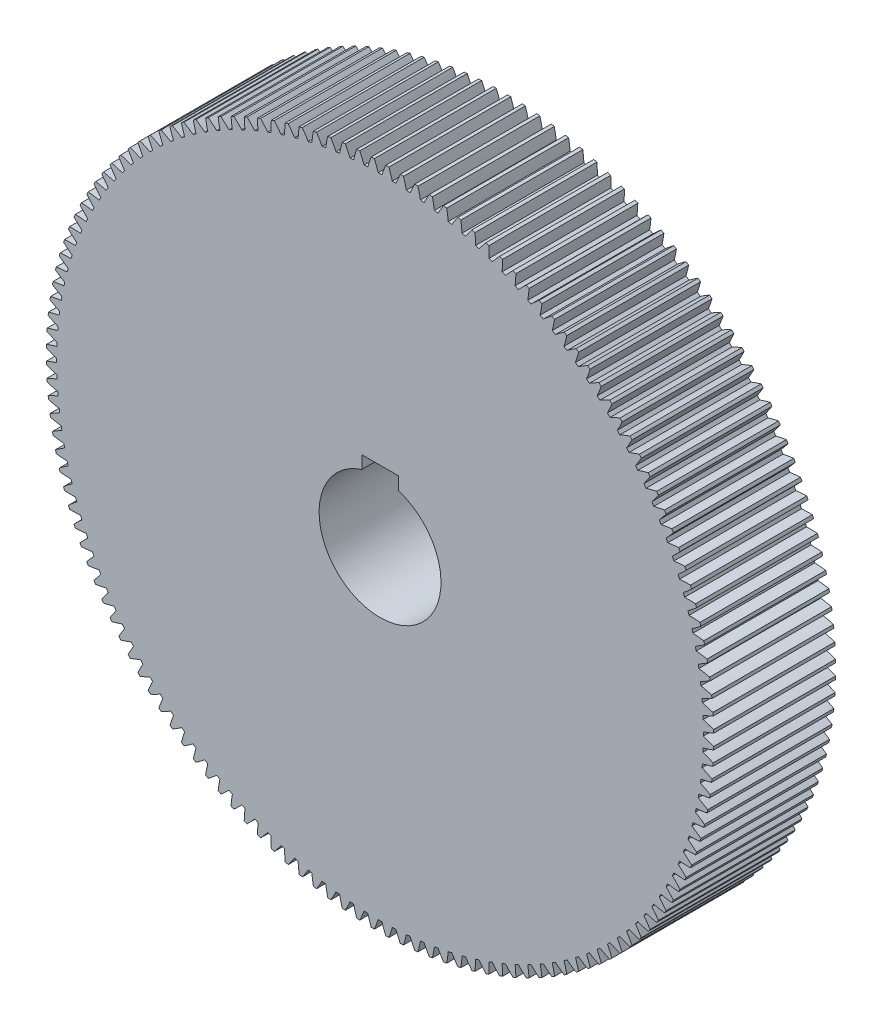
from build123d import *

# Parameters (mm, degrees)
EXTRUDE_1_DEPTH = 40


with BuildPart() as part:
    # Model → 凸台-拉伸1 (new body)
    with BuildSketch(Plane.XY):
        with BuildLine():
            ThreePointArc((-109.483974334, 1.873329678), (-107.816326162, 1.203872308), (-106.122279181, 0.604348814))
            ThreePointArc((-106.122279181, 0.604348814), (-106.124, 0), (-106.122279181, -0.604348814))
            ThreePointArc((-106.122279181, -0.604348814), (-107.816326162, -1.203872308), (-109.483974334, -1.873329678))
            ThreePointArc((-109.483974334, -1.873329678), (-109.473941965, -2.388729911), (-109.461483343, -2.904077204))
            ThreePointArc((-109.461483343, -2.904077204), (-107.766221082, -3.500155607), (-106.047635611, -4.025215196))
            ThreePointArc((-106.047635611, -4.025215196), (-106.022993467, -4.629063865), (-105.994912961, -5.232762411))
            ThreePointArc((-105.994912961, -5.232762411), (-107.661196737, -5.905608583), (-109.298056357, -6.64717057))
            ThreePointArc((-109.298056357, -6.64717057), (-109.265552095, -7.161642651), (-109.230626197, -7.67595601))
            ThreePointArc((-109.230626197, -7.67595601), (-107.510976876, -8.197520777), (-105.771124339, -8.64711698))
            ThreePointArc((-105.771124339, -8.64711698), (-105.72016614, -9.249316043), (-105.6657794, -9.851215148))
            ThreePointArc((-105.6657794, -9.851215148), (-107.301128105, -10.596103197), (-108.904083318, -11.408358195))
            ThreePointArc((-108.904083318, -11.408358195), (-108.849169035, -11.920922796), (-108.791842346, -12.433223197))
            ThreePointArc((-108.791842346, -12.433223197), (-107.051079414, -12.8792815), (-105.29327172, -13.252558486))
            ThreePointArc((-105.29327172, -13.252558486), (-105.216094468, -13.851961623), (-105.135505022, -14.450915537))
            ThreePointArc((-105.135505022, -14.450915537), (-106.736805677, -15.266427526), (-108.302805166, -16.147829361))
            ThreePointArc((-108.302805166, -16.147829361), (-108.225585396, -16.657510788), (-108.145967039, -17.166823036))
            ThreePointArc((-108.145967039, -17.166823036), (-106.387404138, -17.536525779), (-104.614987375, -17.832772993))
            ThreePointArc((-104.614987375, -17.832772993), (-104.511737981, -18.428239207), (-104.405099234, -19.023107787))
            ThreePointArc((-104.405099234, -19.023107787), (-105.969303673, -19.907691343), (-107.49536647, -20.856562217))
            ThreePointArc((-107.49536647, -20.856562217), (-107.395988204, -21.362390261), (-107.294229738, -21.867744853))
            ThreePointArc((-107.294229738, -21.867744853), (-105.521214392, -22.160388284), (-103.737562454, -22.379041803))
            ThreePointArc((-103.737562454, -22.379041803), (-103.60843746, -22.96943759), (-103.475952407, -23.55908847))
            ThreePointArc((-103.475952407, -23.55908847), (-105.000083077, -24.511059738), (-106.483304234, -25.525593421))
            ThreePointArc((-106.483304234, -25.525593421), (-106.361956645, -26.02660521), (-106.238251772, -26.527040174))
            ThreePointArc((-106.238251772, -26.527040174), (-104.454159017, -26.74206723), (-102.662667188, -26.882710835))
            ThreePointArc((-102.662667188, -26.882710835), (-102.507912389, -27.466912343), (-102.349833222, -28.050223089))
            ThreePointArc((-102.349833222, -28.050223089), (-103.830988854, -29.067769937), (-105.268544975, -30.146035208))
            ThreePointArc((-105.268544975, -30.146035208), (-105.125459055, -30.641277036), (-104.980043256, -31.135839767))
            ThreePointArc((-104.980043256, -31.135839767), (-103.188269213, -31.272841132), (-101.3923477, -31.335207099))
            ThreePointArc((-101.3923477, -31.335207099), (-101.212257681, -31.912102267), (-101.028885314, -32.487962514))
            ThreePointArc((-101.028885314, -32.487962514), (-102.464246443, -33.569147984), (-103.853401059, -34.709092303))
            ThreePointArc((-103.853401059, -34.709092303), (-103.68884918, -35.197621451), (-103.521999261, -35.685370519))
            ThreePointArc((-103.521999261, -35.685370519), (-101.725954674, -35.744085403), (-99.929022115, -35.728055015))
            ThreePointArc((-99.929022115, -35.728055015), (-99.723939688, -36.29654569), (-99.515623179, -36.863859256))
            ThreePointArc((-99.515623179, -36.863859256), (-100.902457516, -38.006625251), (-102.240566291, -39.206078668))
            ThreePointArc((-102.240566291, -39.206078668), (-102.054861686, -39.686965192), (-101.866895256, -40.16697214))
            ThreePointArc((-101.866895256, -40.16697214), (-100.069998998, -40.147288776), (-98.275475957, -40.052892548))
            ThreePointArc((-98.275475957, -40.052892548), (-98.045791508, -40.611896576), (-97.8129274, -41.169583547))
            ThreePointArc((-97.8129274, -41.169583547), (-99.148595025, -42.371754745), (-100.433110794, -43.628434034))
            ThreePointArc((-100.433110794, -43.628434034), (-100.226606964, -44.10076254), (-100.017881826, -44.572113647))
            ThreePointArc((-100.017881826, -44.572113647), (-98.223554392, -44.474069503), (-96.434856845, -44.301487124))
            ThreePointArc((-96.434856845, -44.301487124), (-96.181007591, -44.849940409), (-95.924039154, -45.396939195))
            ThreePointArc((-95.924039154, -45.396939195), (-97.205997548, -46.656227197), (-98.434475162, -47.967740196))
            ThreePointArc((-98.434475162, -47.967740196), (-98.207565198, -48.430611579), (-97.978478674, -48.892409602))
            ThreePointArc((-97.978478674, -48.892409602), (-96.190135668, -48.716191311), (-94.410668501, -48.4657513))
            ThreePointArc((-94.410668501, -48.4657513), (-94.13313766, -49.002609831), (-93.852554048, -49.53787919))
            ThreePointArc((-93.852554048, -49.53787919), (-95.078362931, -50.851886868), (-96.248463913, -52.215737038))
            ThreePointArc((-96.248463913, -52.215737038), (-96.00157975, -52.668270197), (-95.752567919, -53.119636077))
            ThreePointArc((-95.752567919, -53.119636077), (-93.973613553, -52.86557908), (-92.206764085, -52.537758165))
            ThreePointArc((-92.206764085, -52.537758165), (-91.906079951, -53.062), (-91.602415271, -53.584521016))
            ThreePointArc((-91.602415271, -53.584521016), (-92.769741245, -54.950747082), (-93.879238242, -56.364338257))
            ThreePointArc((-93.879238242, -56.364338257), (-93.612849839, -56.805671769), (-93.344386709, -57.245746305))
            ThreePointArc((-93.344386709, -57.245746305), (-91.578207323, -56.914334214), (-89.827338852, -56.509756421))
            ThreePointArc((-89.827338852, -56.509756421), (-89.504073795, -57.020383636), (-89.17790609, -57.52916166))
            ThreePointArc((-89.17790609, -57.52916166), (-90.284527085, -58.945005426), (-91.331308105, -60.405646755))
            ThreePointArc((-91.331308105, -60.405646755), (-91.045922547, -60.834940516), (-90.758519153, -61.262886001))
            ThreePointArc((-90.758519153, -61.262886001), (-89.008476771, -60.854749679), (-87.276922174, -60.374185144))
            ThreePointArc((-87.276922174, -60.374185144), (-86.931691548, -60.870225731), (-86.583641697, -61.364292276))
            ThreePointArc((-86.583641697, -61.364292276), (-87.627451195, -62.827058602), (-88.609523632, -64.331969671))
            ThreePointArc((-88.609523632, -64.331969671), (-88.305684167, -64.748406496), (-87.999887598, -65.163408312))
            ThreePointArc((-87.999887598, -65.163408312), (-86.269313525, -64.679324668), (-84.560368915, -64.123688174))
            ThreePointArc((-84.560368915, -64.123688174), (-84.193829885, -64.604197892), (-83.82456042, -65.082612474))
            ThreePointArc((-83.82456042, -65.082612474), (-84.803571472, -66.589516901), (-85.719065895, -68.135833026))
            ThreePointArc((-85.719065895, -68.135833026), (-85.397350899, -68.538620204), (-85.073743255, -68.939888371))
            ThreePointArc((-85.073743255, -68.939888371), (-83.365931737, -68.380778887), (-81.682850187, -67.751128119))
            ThreePointArc((-81.682850187, -67.751128119), (-81.295700482, -68.21519229), (-80.905914328, -68.677044219))
            ThreePointArc((-80.905914328, -68.677044219), (-81.818263331, -70.22521827), (-82.665437043, -71.809995951))
            ThreePointArc((-82.665437043, -71.809995951), (-82.326458919, -72.198366753), (-81.985656206, -72.585137435))
            ThreePointArc((-81.985656206, -72.585137435), (-80.30385816, -71.952066407), (-78.649843511, -71.249599941))
            ThreePointArc((-78.649843511, -71.249599941), (-78.242820092, -71.696335193), (-77.83325923, -72.140745308))
            ThreePointArc((-77.83325923, -72.140745308), (-78.677209475, -73.727241945), (-79.454449834, -75.347464466))
            ThreePointArc((-79.454449834, -75.347464466), (-79.098853846, -75.720679608), (-78.741504801, -76.092216564))
            ThreePointArc((-78.741504801, -76.092216564), (-77.088921624, -75.386389079), (-75.467122388, -74.612444099))
            ThreePointArc((-75.467122388, -74.612444099), (-75.041000047, -75.041000047), (-74.612444099, -75.467122388))
            ThreePointArc((-74.612444099, -75.467122388), (-75.386389079, -77.088921624), (-76.092216564, -78.741504801))
            ThreePointArc((-76.092216564, -78.741504801), (-75.720679608, -79.098853846), (-75.347464466, -79.454449834))
            ThreePointArc((-75.347464466, -79.454449834), (-73.727241945, -78.677209475), (-72.140745308, -77.83325923))
            ThreePointArc((-72.140745308, -77.83325923), (-71.696335193, -78.242820092), (-71.249599941, -78.649843511))
            ThreePointArc((-71.249599941, -78.649843511), (-71.952066407, -80.30385816), (-72.585137435, -81.985656206))
            ThreePointArc((-72.585137435, -81.985656206), (-72.198366753, -82.326458919), (-71.809995951, -82.665437043))
            ThreePointArc((-71.809995951, -82.665437043), (-70.22521827, -81.818263331), (-68.677044219, -80.905914328))
            ThreePointArc((-68.677044219, -80.905914328), (-68.21519229, -81.295700482), (-67.751128119, -81.682850187))
            ThreePointArc((-67.751128119, -81.682850187), (-68.380778887, -83.365931737), (-68.939888371, -85.073743255))
            ThreePointArc((-68.939888371, -85.073743255), (-68.538620204, -85.397350899), (-68.135833026, -85.719065895))
            ThreePointArc((-68.135833026, -85.719065895), (-66.589516901, -84.803571472), (-65.082612474, -83.82456042))
            ThreePointArc((-65.082612474, -83.82456042), (-64.604197892, -84.193829885), (-64.123688174, -84.560368915))
            ThreePointArc((-64.123688174, -84.560368915), (-64.679324668, -86.269313525), (-65.163408312, -87.999887598))
            ThreePointArc((-65.163408312, -87.999887598), (-64.748406496, -88.305684167), (-64.331969671, -88.609523632))
            ThreePointArc((-64.331969671, -88.609523632), (-62.827058602, -87.627451195), (-61.364292276, -86.583641697))
            ThreePointArc((-61.364292276, -86.583641697), (-60.870225731, -86.931691548), (-60.374185144, -87.276922174))
            ThreePointArc((-60.374185144, -87.276922174), (-60.854749679, -89.008476771), (-61.262886001, -90.758519153))
            ThreePointArc((-61.262886001, -90.758519153), (-60.834940516, -91.045922547), (-60.405646755, -91.331308105))
            ThreePointArc((-60.405646755, -91.331308105), (-58.945005426, -90.284527085), (-57.52916166, -89.17790609))
            ThreePointArc((-57.52916166, -89.17790609), (-57.020383636, -89.504073795), (-56.509756421, -89.827338852))
            ThreePointArc((-56.509756421, -89.827338852), (-56.914334214, -91.578207323), (-57.245746305, -93.344386709))
            ThreePointArc((-57.245746305, -93.344386709), (-56.805671769, -93.612849839), (-56.364338257, -93.879238242))
            ThreePointArc((-56.364338257, -93.879238242), (-54.950747082, -92.769741245), (-53.584521016, -91.602415271))
            ThreePointArc((-53.584521016, -91.602415271), (-53.062, -91.906079951), (-52.537758165, -92.206764085))
            ThreePointArc((-52.537758165, -92.206764085), (-52.86557908, -93.973613553), (-53.119636076, -95.752567919))
            ThreePointArc((-53.119636076, -95.752567919), (-52.668270197, -96.00157975), (-52.215737038, -96.248463913))
            ThreePointArc((-52.215737038, -96.248463913), (-50.851886868, -95.078362931), (-49.53787919, -93.852554048))
            ThreePointArc((-49.53787919, -93.852554048), (-49.002609831, -94.13313766), (-48.4657513, -94.410668501))
            ThreePointArc((-48.4657513, -94.410668501), (-48.716191311, -96.190135668), (-48.892409602, -97.978478674))
            ThreePointArc((-48.892409602, -97.978478674), (-48.430611579, -98.207565198), (-47.967740196, -98.434475162))
            ThreePointArc((-47.967740196, -98.434475162), (-46.656227197, -97.205997548), (-45.396939195, -95.924039155))
            ThreePointArc((-45.396939195, -95.924039155), (-44.849940409, -96.181007591), (-44.301487124, -96.434856845))
            ThreePointArc((-44.301487124, -96.434856845), (-44.474069503, -98.223554392), (-44.572113647, -100.017881826))
            ThreePointArc((-44.572113647, -100.017881826), (-44.10076254, -100.226606964), (-43.628434034, -100.433110794))
            ThreePointArc((-43.628434034, -100.433110794), (-42.371754745, -99.148595025), (-41.169583547, -97.8129274))
            ThreePointArc((-41.169583547, -97.8129274), (-40.611896576, -98.045791508), (-40.052892548, -98.275475957))
            ThreePointArc((-40.052892548, -98.275475957), (-40.147288776, -100.069998998), (-40.16697214, -101.866895256))
            ThreePointArc((-40.16697214, -101.866895256), (-39.686965192, -102.054861686), (-39.206078668, -102.240566291))
            ThreePointArc((-39.206078668, -102.240566291), (-38.006625251, -100.902457516), (-36.863859256, -99.515623179))
            ThreePointArc((-36.863859256, -99.515623179), (-36.29654569, -99.723939688), (-35.728055015, -99.929022115))
            ThreePointArc((-35.728055015, -99.929022115), (-35.744085403, -101.725954674), (-35.685370519, -103.521999261))
            ThreePointArc((-35.685370519, -103.521999261), (-35.197621451, -103.68884918), (-34.709092303, -103.853401059))
            ThreePointArc((-34.709092303, -103.853401059), (-33.569147984, -102.464246443), (-32.487962514, -101.028885314))
            ThreePointArc((-32.487962514, -101.028885314), (-31.912102267, -101.212257681), (-31.335207099, -101.3923477))
            ThreePointArc((-31.335207099, -101.3923477), (-31.272841132, -103.188269213), (-31.135839767, -104.980043256))
            ThreePointArc((-31.135839767, -104.980043256), (-30.641277036, -105.125459055), (-30.146035208, -105.268544975))
            ThreePointArc((-30.146035208, -105.268544975), (-29.067769937, -103.830988854), (-28.050223089, -102.349833223))
            ThreePointArc((-28.050223089, -102.349833223), (-27.466912342, -102.507912389), (-26.882710835, -102.662667188))
            ThreePointArc((-26.882710835, -102.662667188), (-26.74206723, -104.454159017), (-26.527040174, -106.238251772))
            ThreePointArc((-26.527040174, -106.238251772), (-26.02660521, -106.361956645), (-25.525593421, -106.483304234))
            ThreePointArc((-25.525593421, -106.483304234), (-24.511059738, -105.000083077), (-23.55908847, -103.475952407))
            ThreePointArc((-23.55908847, -103.475952407), (-22.96943759, -103.60843746), (-22.379041802, -103.737562455))
            ThreePointArc((-22.379041802, -103.737562455), (-22.160388284, -105.521214392), (-21.867744853, -107.294229738))
            ThreePointArc((-21.867744853, -107.294229738), (-21.362390261, -107.395988204), (-20.856562217, -107.49536647))
            ThreePointArc((-20.856562217, -107.49536647), (-19.907691343, -105.969303673), (-19.023107787, -104.405099234))
            ThreePointArc((-19.023107787, -104.405099234), (-18.428239207, -104.511737981), (-17.832772992, -104.614987375))
            ThreePointArc((-17.832772992, -104.614987375), (-17.536525779, -106.387404138), (-17.166823036, -108.145967039))
            ThreePointArc((-17.166823036, -108.145967039), (-16.657510788, -108.225585396), (-16.147829361, -108.302805166))
            ThreePointArc((-16.147829361, -108.302805166), (-15.266427526, -106.736805677), (-14.450915537, -105.135505022))
            ThreePointArc((-14.450915537, -105.135505022), (-13.851961623, -105.216094468), (-13.252558486, -105.29327172))
            ThreePointArc((-13.252558486, -105.29327172), (-12.8792815, -107.051079414), (-12.433223196, -108.791842346))
            ThreePointArc((-12.433223196, -108.791842346), (-11.920922796, -108.849169035), (-11.408358195, -108.904083318))
            ThreePointArc((-11.408358195, -108.904083318), (-10.596103197, -107.301128105), (-9.851215148, -105.6657794))
            ThreePointArc((-9.851215148, -105.6657794), (-9.249316043, -105.72016614), (-8.64711698, -105.771124339))
            ThreePointArc((-8.64711698, -105.771124339), (-8.197520777, -107.510976876), (-7.675956009, -109.230626197))
            ThreePointArc((-7.675956009, -109.230626197), (-7.161642651, -109.265552095), (-6.647170569, -109.298056357))
            ThreePointArc((-6.647170569, -109.298056357), (-5.905608583, -107.661196737), (-5.232762411, -105.994912961))
            ThreePointArc((-5.232762411, -105.994912961), (-4.629063865, -106.022993467), (-4.025215196, -106.047635611))
            ThreePointArc((-4.025215196, -106.047635611), (-3.500155607, -107.766221082), (-2.904077204, -109.461483343))
            ThreePointArc((-2.904077204, -109.461483343), (-2.388729911, -109.473941965), (-1.873329678, -109.483974334))
            ThreePointArc((-1.873329678, -109.483974334), (-1.203872308, -107.816326162), (-0.604348814, -106.122279181))
            ThreePointArc((-0.604348814, -106.122279181), (0, -106.124), (0.604348814, -106.122279181))
            ThreePointArc((0.604348814, -106.122279181), (1.203872308, -107.816326162), (1.873329678, -109.483974334))
            ThreePointArc((1.873329678, -109.483974334), (2.388729911, -109.473941965), (2.904077204, -109.461483343))
            ThreePointArc((2.904077204, -109.461483343), (3.500155607, -107.766221082), (4.025215196, -106.047635611))
            ThreePointArc((4.025215196, -106.047635611), (4.629063865, -106.022993467), (5.232762411, -105.994912961))
            ThreePointArc((5.232762411, -105.994912961), (5.905608583, -107.661196737), (6.64717057, -109.298056357))
            ThreePointArc((6.64717057, -109.298056357), (7.161642651, -109.265552095), (7.67595601, -109.230626197))
            ThreePointArc((7.67595601, -109.230626197), (8.197520777, -107.510976876), (8.64711698, -105.771124339))
            ThreePointArc((8.64711698, -105.771124339), (9.249316043, -105.72016614), (9.851215148, -105.6657794))
            ThreePointArc((9.851215148, -105.6657794), (10.596103197, -107.301128105), (11.408358195, -108.904083318))
            ThreePointArc((11.408358195, -108.904083318), (11.920922796, -108.849169035), (12.433223197, -108.791842346))
            ThreePointArc((12.433223197, -108.791842346), (12.8792815, -107.051079414), (13.252558486, -105.29327172))
            ThreePointArc((13.252558486, -105.29327172), (13.851961623, -105.216094468), (14.450915537, -105.135505022))
            ThreePointArc((14.450915537, -105.135505022), (15.266427526, -106.736805677), (16.147829361, -108.302805166))
            ThreePointArc((16.147829361, -108.302805166), (16.657510788, -108.225585396), (17.166823036, -108.145967039))
            ThreePointArc((17.166823036, -108.145967039), (17.536525779, -106.387404138), (17.832772993, -104.614987375))
            ThreePointArc((17.832772993, -104.614987375), (18.428239207, -104.511737981), (19.023107787, -104.405099234))
            ThreePointArc((19.023107787, -104.405099234), (19.907691343, -105.969303673), (20.856562217, -107.49536647))
            ThreePointArc((20.856562217, -107.49536647), (21.362390261, -107.395988204), (21.867744853, -107.294229738))
            ThreePointArc((21.867744853, -107.294229738), (22.160388284, -105.521214392), (22.379041803, -103.737562454))
            ThreePointArc((22.379041803, -103.737562454), (22.96943759, -103.60843746), (23.55908847, -103.475952407))
            ThreePointArc((23.55908847, -103.475952407), (24.511059738, -105.000083077), (25.525593421, -106.483304234))
            ThreePointArc((25.525593421, -106.483304234), (26.02660521, -106.361956645), (26.527040174, -106.238251772))
            ThreePointArc((26.527040174, -106.238251772), (26.74206723, -104.454159017), (26.882710835, -102.662667188))
            ThreePointArc((26.882710835, -102.662667188), (27.466912343, -102.507912389), (28.050223089, -102.349833222))
            ThreePointArc((28.050223089, -102.349833222), (29.067769937, -103.830988854), (30.146035208, -105.268544975))
            ThreePointArc((30.146035208, -105.268544975), (30.641277036, -105.125459055), (31.135839767, -104.980043256))
            ThreePointArc((31.135839767, -104.980043256), (31.272841132, -103.188269213), (31.335207099, -101.3923477))
            ThreePointArc((31.335207099, -101.3923477), (31.912102267, -101.212257681), (32.487962514, -101.028885314))
            ThreePointArc((32.487962514, -101.028885314), (33.569147984, -102.464246443), (34.709092303, -103.853401059))
            ThreePointArc((34.709092303, -103.853401059), (35.197621451, -103.68884918), (35.685370519, -103.521999261))
            ThreePointArc((35.685370519, -103.521999261), (35.744085403, -101.725954674), (35.728055015, -99.929022115))
            ThreePointArc((35.728055015, -99.929022115), (36.29654569, -99.723939688), (36.863859256, -99.515623179))
            ThreePointArc((36.863859256, -99.515623179), (38.006625251, -100.902457516), (39.206078668, -102.240566291))
            ThreePointArc((39.206078668, -102.240566291), (39.686965192, -102.054861686), (40.16697214, -101.866895256))
            ThreePointArc((40.16697214, -101.866895256), (40.147288776, -100.069998998), (40.052892548, -98.275475957))
            ThreePointArc((40.052892548, -98.275475957), (40.611896576, -98.045791508), (41.169583547, -97.8129274))
            ThreePointArc((41.169583547, -97.8129274), (42.371754745, -99.148595025), (43.628434034, -100.433110794))
            ThreePointArc((43.628434034, -100.433110794), (44.10076254, -100.226606964), (44.572113647, -100.017881826))
            ThreePointArc((44.572113647, -100.017881826), (44.474069503, -98.223554392), (44.301487124, -96.434856845))
            ThreePointArc((44.301487124, -96.434856845), (44.849940409, -96.181007591), (45.396939195, -95.924039154))
            ThreePointArc((45.396939195, -95.924039154), (46.656227197, -97.205997548), (47.967740196, -98.434475162))
            ThreePointArc((47.967740196, -98.434475162), (48.430611579, -98.207565198), (48.892409602, -97.978478674))
            ThreePointArc((48.892409602, -97.978478674), (48.716191311, -96.190135668), (48.4657513, -94.410668501))
            ThreePointArc((48.4657513, -94.410668501), (49.002609831, -94.13313766), (49.53787919, -93.852554048))
            ThreePointArc((49.53787919, -93.852554048), (50.851886868, -95.078362931), (52.215737038, -96.248463913))
            ThreePointArc((52.215737038, -96.248463913), (52.668270197, -96.00157975), (53.119636077, -95.752567919))
            ThreePointArc((53.119636077, -95.752567919), (52.86557908, -93.973613553), (52.537758165, -92.206764085))
            ThreePointArc((52.537758165, -92.206764085), (53.062, -91.906079951), (53.584521016, -91.602415271))
            ThreePointArc((53.584521016, -91.602415271), (54.950747082, -92.769741245), (56.364338257, -93.879238242))
            ThreePointArc((56.364338257, -93.879238242), (56.805671769, -93.612849839), (57.245746305, -93.344386709))
            ThreePointArc((57.245746305, -93.344386709), (56.914334214, -91.578207323), (56.509756421, -89.827338852))
            ThreePointArc((56.509756421, -89.827338852), (57.020383636, -89.504073795), (57.52916166, -89.17790609))
            ThreePointArc((57.52916166, -89.17790609), (58.945005426, -90.284527085), (60.405646755, -91.331308105))
            ThreePointArc((60.405646755, -91.331308105), (60.834940516, -91.045922547), (61.262886001, -90.758519153))
            ThreePointArc((61.262886001, -90.758519153), (60.854749679, -89.008476771), (60.374185144, -87.276922174))
            ThreePointArc((60.374185144, -87.276922174), (60.870225731, -86.931691548), (61.364292276, -86.583641697))
            ThreePointArc((61.364292276, -86.583641697), (62.827058602, -87.627451195), (64.331969671, -88.609523632))
            ThreePointArc((64.331969671, -88.609523632), (64.748406496, -88.305684167), (65.163408312, -87.999887598))
            ThreePointArc((65.163408312, -87.999887598), (64.679324668, -86.269313525), (64.123688174, -84.560368915))
            ThreePointArc((64.123688174, -84.560368915), (64.604197892, -84.193829885), (65.082612474, -83.82456042))
            ThreePointArc((65.082612474, -83.82456042), (66.589516901, -84.803571472), (68.135833026, -85.719065895))
            ThreePointArc((68.135833026, -85.719065895), (68.538620204, -85.397350899), (68.939888371, -85.073743255))
            ThreePointArc((68.939888371, -85.073743255), (68.380778887, -83.365931737), (67.751128119, -81.682850187))
            ThreePointArc((67.751128119, -81.682850187), (68.21519229, -81.295700482), (68.677044219, -80.905914328))
            ThreePointArc((68.677044219, -80.905914328), (70.22521827, -81.818263331), (71.809995951, -82.665437043))
            ThreePointArc((71.809995951, -82.665437043), (72.198366753, -82.326458919), (72.585137435, -81.985656206))
            ThreePointArc((72.585137435, -81.985656206), (71.952066407, -80.30385816), (71.249599941, -78.649843511))
            ThreePointArc((71.249599941, -78.649843511), (71.696335193, -78.242820092), (72.140745308, -77.83325923))
            ThreePointArc((72.140745308, -77.83325923), (73.727241945, -78.677209475), (75.347464466, -79.454449834))
            ThreePointArc((75.347464466, -79.454449834), (75.720679608, -79.098853846), (76.092216564, -78.741504801))
            ThreePointArc((76.092216564, -78.741504801), (75.386389079, -77.088921624), (74.612444099, -75.467122388))
            ThreePointArc((74.612444099, -75.467122388), (75.041000047, -75.041000047), (75.467122388, -74.612444099))
            ThreePointArc((75.467122388, -74.612444099), (77.088921624, -75.386389079), (78.741504801, -76.092216564))
            ThreePointArc((78.741504801, -76.092216564), (79.098853846, -75.720679608), (79.454449834, -75.347464466))
            ThreePointArc((79.454449834, -75.347464466), (78.677209475, -73.727241945), (77.83325923, -72.140745308))
            ThreePointArc((77.83325923, -72.140745308), (78.242820092, -71.696335193), (78.649843511, -71.249599941))
            ThreePointArc((78.649843511, -71.249599941), (80.30385816, -71.952066407), (81.985656206, -72.585137435))
            ThreePointArc((81.985656206, -72.585137435), (82.326458919, -72.198366753), (82.665437043, -71.809995951))
            ThreePointArc((82.665437043, -71.809995951), (81.818263331, -70.22521827), (80.905914328, -68.677044219))
            ThreePointArc((80.905914328, -68.677044219), (81.295700482, -68.21519229), (81.682850187, -67.751128119))
            ThreePointArc((81.682850187, -67.751128119), (83.365931737, -68.380778887), (85.073743255, -68.939888371))
            ThreePointArc((85.073743255, -68.939888371), (85.397350899, -68.538620204), (85.719065895, -68.135833026))
            ThreePointArc((85.719065895, -68.135833026), (84.803571472, -66.589516901), (83.82456042, -65.082612474))
            ThreePointArc((83.82456042, -65.082612474), (84.193829885, -64.604197892), (84.560368915, -64.123688174))
            ThreePointArc((84.560368915, -64.123688174), (86.269313525, -64.679324668), (87.999887598, -65.163408312))
            ThreePointArc((87.999887598, -65.163408312), (88.305684167, -64.748406496), (88.609523632, -64.331969671))
            ThreePointArc((88.609523632, -64.331969671), (87.627451195, -62.827058602), (86.583641697, -61.364292276))
            ThreePointArc((86.583641697, -61.364292276), (86.931691548, -60.870225731), (87.276922174, -60.374185144))
            ThreePointArc((87.276922174, -60.374185144), (89.008476771, -60.854749679), (90.758519153, -61.262886001))
            ThreePointArc((90.758519153, -61.262886001), (91.045922547, -60.834940516), (91.331308105, -60.405646755))
            ThreePointArc((91.331308105, -60.405646755), (90.284527085, -58.945005426), (89.17790609, -57.52916166))
            ThreePointArc((89.17790609, -57.52916166), (89.504073795, -57.020383636), (89.827338852, -56.509756421))
            ThreePointArc((89.827338852, -56.509756421), (91.578207323, -56.914334214), (93.344386709, -57.245746305))
            ThreePointArc((93.344386709, -57.245746305), (93.612849839, -56.805671769), (93.879238242, -56.364338257))
            ThreePointArc((93.879238242, -56.364338257), (92.769741245, -54.950747082), (91.602415271, -53.584521016))
            ThreePointArc((91.602415271, -53.584521016), (91.906079951, -53.062), (92.206764085, -52.537758165))
            ThreePointArc((92.206764085, -52.537758165), (93.973613553, -52.86557908), (95.752567919, -53.119636076))
            ThreePointArc((95.752567919, -53.119636076), (96.00157975, -52.668270197), (96.248463913, -52.215737038))
            ThreePointArc((96.248463913, -52.215737038), (95.078362931, -50.851886868), (93.852554048, -49.53787919))
            ThreePointArc((93.852554048, -49.53787919), (94.13313766, -49.002609831), (94.410668501, -48.4657513))
            ThreePointArc((94.410668501, -48.4657513), (96.190135668, -48.716191311), (97.978478674, -48.892409602))
            ThreePointArc((97.978478674, -48.892409602), (98.207565198, -48.430611579), (98.434475162, -47.967740196))
            ThreePointArc((98.434475162, -47.967740196), (97.205997548, -46.656227197), (95.924039155, -45.396939195))
            ThreePointArc((95.924039155, -45.396939195), (96.181007591, -44.849940409), (96.434856845, -44.301487124))
            ThreePointArc((96.434856845, -44.301487124), (98.223554392, -44.474069503), (100.017881826, -44.572113647))
            ThreePointArc((100.017881826, -44.572113647), (100.226606964, -44.10076254), (100.433110794, -43.628434034))
            ThreePointArc((100.433110794, -43.628434034), (99.148595025, -42.371754745), (97.8129274, -41.169583547))
            ThreePointArc((97.8129274, -41.169583547), (98.045791508, -40.611896576), (98.275475957, -40.052892548))
            ThreePointArc((98.275475957, -40.052892548), (100.069998998, -40.147288776), (101.866895256, -40.16697214))
            ThreePointArc((101.866895256, -40.16697214), (102.054861686, -39.686965192), (102.240566291, -39.206078668))
            ThreePointArc((102.240566291, -39.206078668), (100.902457516, -38.006625251), (99.515623179, -36.863859256))
            ThreePointArc((99.515623179, -36.863859256), (99.723939688, -36.29654569), (99.929022115, -35.728055015))
            ThreePointArc((99.929022115, -35.728055015), (101.725954674, -35.744085403), (103.521999261, -35.685370519))
            ThreePointArc((103.521999261, -35.685370519), (103.68884918, -35.197621451), (103.853401059, -34.709092303))
            ThreePointArc((103.853401059, -34.709092303), (102.464246443, -33.569147984), (101.028885314, -32.487962514))
            ThreePointArc((101.028885314, -32.487962514), (101.212257681, -31.912102267), (101.3923477, -31.335207099))
            ThreePointArc((101.3923477, -31.335207099), (103.188269213, -31.272841132), (104.980043256, -31.135839767))
            ThreePointArc((104.980043256, -31.135839767), (105.125459055, -30.641277036), (105.268544975, -30.146035208))
            ThreePointArc((105.268544975, -30.146035208), (103.830988854, -29.067769937), (102.349833223, -28.050223089))
            ThreePointArc((102.349833223, -28.050223089), (102.507912389, -27.466912342), (102.662667188, -26.882710835))
            ThreePointArc((102.662667188, -26.882710835), (104.454159017, -26.74206723), (106.238251772, -26.527040174))
            ThreePointArc((106.238251772, -26.527040174), (106.361956645, -26.02660521), (106.483304234, -25.525593421))
            ThreePointArc((106.483304234, -25.525593421), (105.000083077, -24.511059738), (103.475952407, -23.55908847))
            ThreePointArc((103.475952407, -23.55908847), (103.60843746, -22.96943759), (103.737562455, -22.379041802))
            ThreePointArc((103.737562455, -22.379041802), (105.521214392, -22.160388284), (107.294229738, -21.867744853))
            ThreePointArc((107.294229738, -21.867744853), (107.395988204, -21.362390261), (107.49536647, -20.856562217))
            ThreePointArc((107.49536647, -20.856562217), (105.969303673, -19.907691343), (104.405099234, -19.023107787))
            ThreePointArc((104.405099234, -19.023107787), (104.511737981, -18.428239207), (104.614987375, -17.832772992))
            ThreePointArc((104.614987375, -17.832772992), (106.387404138, -17.536525779), (108.145967039, -17.166823036))
            ThreePointArc((108.145967039, -17.166823036), (108.225585396, -16.657510788), (108.302805166, -16.147829361))
            ThreePointArc((108.302805166, -16.147829361), (106.736805677, -15.266427526), (105.135505022, -14.450915537))
            ThreePointArc((105.135505022, -14.450915537), (105.216094468, -13.851961623), (105.29327172, -13.252558486))
            ThreePointArc((105.29327172, -13.252558486), (107.051079414, -12.8792815), (108.791842346, -12.433223196))
            ThreePointArc((108.791842346, -12.433223196), (108.849169035, -11.920922796), (108.904083318, -11.408358195))
            ThreePointArc((108.904083318, -11.408358195), (107.301128105, -10.596103197), (105.6657794, -9.851215148))
            ThreePointArc((105.6657794, -9.851215148), (105.72016614, -9.249316043), (105.771124339, -8.64711698))
            ThreePointArc((105.771124339, -8.64711698), (107.510976876, -8.197520777), (109.230626197, -7.675956009))
            ThreePointArc((109.230626197, -7.675956009), (109.265552095, -7.161642651), (109.298056357, -6.647170569))
            ThreePointArc((109.298056357, -6.647170569), (107.661196737, -5.905608583), (105.994912961, -5.232762411))
            ThreePointArc((105.994912961, -5.232762411), (106.022993467, -4.629063865), (106.047635611, -4.025215196))
            ThreePointArc((106.047635611, -4.025215196), (107.766221082, -3.500155607), (109.461483343, -2.904077204))
            ThreePointArc((109.461483343, -2.904077204), (109.473941965, -2.388729911), (109.483974334, -1.873329678))
            ThreePointArc((109.483974334, -1.873329678), (107.816326162, -1.203872308), (106.122279181, -0.604348814))
            ThreePointArc((106.122279181, -0.604348814), (106.124, 0), (106.122279181, 0.604348814))
            ThreePointArc((106.122279181, 0.604348814), (107.816326162, 1.203872308), (109.483974334, 1.873329678))
            ThreePointArc((109.483974334, 1.873329678), (109.473941965, 2.388729911), (109.461483343, 2.904077204))
            ThreePointArc((109.461483343, 2.904077204), (107.766221082, 3.500155607), (106.047635611, 4.025215196))
            ThreePointArc((106.047635611, 4.025215196), (106.022993467, 4.629063865), (105.994912961, 5.232762411))
            ThreePointArc((105.994912961, 5.232762411), (107.661196737, 5.905608583), (109.298056357, 6.64717057))
            ThreePointArc((109.298056357, 6.64717057), (109.265552095, 7.161642651), (109.230626197, 7.67595601))
            ThreePointArc((109.230626197, 7.67595601), (107.510976876, 8.197520777), (105.771124339, 8.64711698))
            ThreePointArc((105.771124339, 8.64711698), (105.72016614, 9.249316043), (105.6657794, 9.851215148))
            ThreePointArc((105.6657794, 9.851215148), (107.301128105, 10.596103197), (108.904083318, 11.408358195))
            ThreePointArc((108.904083318, 11.408358195), (108.849169035, 11.920922796), (108.791842346, 12.433223197))
            ThreePointArc((108.791842346, 12.433223197), (107.051079414, 12.8792815), (105.29327172, 13.252558486))
            ThreePointArc((105.29327172, 13.252558486), (105.216094468, 13.851961623), (105.135505022, 14.450915537))
            ThreePointArc((105.135505022, 14.450915537), (106.736805677, 15.266427526), (108.302805166, 16.147829361))
            ThreePointArc((108.302805166, 16.147829361), (108.225585396, 16.657510788), (108.145967039, 17.166823036))
            ThreePointArc((108.145967039, 17.166823036), (106.387404138, 17.536525779), (104.614987375, 17.832772993))
            ThreePointArc((104.614987375, 17.832772993), (104.511737981, 18.428239207), (104.405099234, 19.023107787))
            ThreePointArc((104.405099234, 19.023107787), (105.969303673, 19.907691343), (107.49536647, 20.856562217))
            ThreePointArc((107.49536647, 20.856562217), (107.395988204, 21.362390261), (107.294229738, 21.867744853))
            ThreePointArc((107.294229738, 21.867744853), (105.521214392, 22.160388284), (103.737562454, 22.379041803))
            ThreePointArc((103.737562454, 22.379041803), (103.60843746, 22.96943759), (103.475952407, 23.55908847))
            ThreePointArc((103.475952407, 23.55908847), (105.000083077, 24.511059738), (106.483304234, 25.525593421))
            ThreePointArc((106.483304234, 25.525593421), (106.361956645, 26.02660521), (106.238251772, 26.527040174))
            ThreePointArc((106.238251772, 26.527040174), (104.454159017, 26.74206723), (102.662667188, 26.882710835))
            ThreePointArc((102.662667188, 26.882710835), (102.507912389, 27.466912343), (102.349833222, 28.050223089))
            ThreePointArc((102.349833222, 28.050223089), (103.830988854, 29.067769937), (105.268544975, 30.146035208))
            ThreePointArc((105.268544975, 30.146035208), (105.125459055, 30.641277036), (104.980043256, 31.135839767))
            ThreePointArc((104.980043256, 31.135839767), (103.188269213, 31.272841132), (101.3923477, 31.335207099))
            ThreePointArc((101.3923477, 31.335207099), (101.212257681, 31.912102267), (101.028885314, 32.487962514))
            ThreePointArc((101.028885314, 32.487962514), (102.464246443, 33.569147984), (103.853401059, 34.709092303))
            ThreePointArc((103.853401059, 34.709092303), (103.68884918, 35.197621451), (103.521999261, 35.685370519))
            ThreePointArc((103.521999261, 35.685370519), (101.725954674, 35.744085403), (99.929022115, 35.728055015))
            ThreePointArc((99.929022115, 35.728055015), (99.723939688, 36.29654569), (99.515623179, 36.863859256))
            ThreePointArc((99.515623179, 36.863859256), (100.902457516, 38.006625251), (102.240566291, 39.206078668))
            ThreePointArc((102.240566291, 39.206078668), (102.054861686, 39.686965192), (101.866895256, 40.16697214))
            ThreePointArc((101.866895256, 40.16697214), (100.069998998, 40.147288776), (98.275475957, 40.052892548))
            ThreePointArc((98.275475957, 40.052892548), (98.045791508, 40.611896576), (97.8129274, 41.169583547))
            ThreePointArc((97.8129274, 41.169583547), (99.148595025, 42.371754745), (100.433110794, 43.628434034))
            ThreePointArc((100.433110794, 43.628434034), (100.226606964, 44.10076254), (100.017881826, 44.572113647))
            ThreePointArc((100.017881826, 44.572113647), (98.223554392, 44.474069503), (96.434856845, 44.301487124))
            ThreePointArc((96.434856845, 44.301487124), (96.181007591, 44.849940409), (95.924039154, 45.396939195))
            ThreePointArc((95.924039154, 45.396939195), (97.205997548, 46.656227197), (98.434475162, 47.967740196))
            ThreePointArc((98.434475162, 47.967740196), (98.207565198, 48.430611579), (97.978478674, 48.892409602))
            ThreePointArc((97.978478674, 48.892409602), (96.190135668, 48.716191311), (94.410668501, 48.4657513))
            ThreePointArc((94.410668501, 48.4657513), (94.13313766, 49.002609831), (93.852554048, 49.53787919))
            ThreePointArc((93.852554048, 49.53787919), (95.078362931, 50.851886868), (96.248463913, 52.215737038))
            ThreePointArc((96.248463913, 52.215737038), (96.00157975, 52.668270197), (95.752567919, 53.119636077))
            ThreePointArc((95.752567919, 53.119636077), (93.973613553, 52.86557908), (92.206764085, 52.537758165))
            ThreePointArc((92.206764085, 52.537758165), (91.906079951, 53.062), (91.602415271, 53.584521016))
            ThreePointArc((91.602415271, 53.584521016), (92.769741245, 54.950747082), (93.879238242, 56.364338257))
            ThreePointArc((93.879238242, 56.364338257), (93.612849839, 56.805671769), (93.344386709, 57.245746305))
            ThreePointArc((93.344386709, 57.245746305), (91.578207323, 56.914334214), (89.827338852, 56.509756421))
            ThreePointArc((89.827338852, 56.509756421), (89.504073795, 57.020383636), (89.17790609, 57.52916166))
            ThreePointArc((89.17790609, 57.52916166), (90.284527085, 58.945005426), (91.331308105, 60.405646755))
            ThreePointArc((91.331308105, 60.405646755), (91.045922547, 60.834940516), (90.758519153, 61.262886001))
            ThreePointArc((90.758519153, 61.262886001), (89.008476771, 60.854749679), (87.276922174, 60.374185144))
            ThreePointArc((87.276922174, 60.374185144), (86.931691548, 60.870225731), (86.583641697, 61.364292276))
            ThreePointArc((86.583641697, 61.364292276), (87.627451195, 62.827058602), (88.609523632, 64.331969671))
            ThreePointArc((88.609523632, 64.331969671), (88.305684167, 64.748406496), (87.999887598, 65.163408312))
            ThreePointArc((87.999887598, 65.163408312), (86.269313525, 64.679324668), (84.560368915, 64.123688174))
            ThreePointArc((84.560368915, 64.123688174), (84.193829885, 64.604197892), (83.82456042, 65.082612474))
            ThreePointArc((83.82456042, 65.082612474), (84.803571472, 66.589516901), (85.719065895, 68.135833026))
            ThreePointArc((85.719065895, 68.135833026), (85.397350899, 68.538620204), (85.073743255, 68.939888371))
            ThreePointArc((85.073743255, 68.939888371), (83.365931737, 68.380778887), (81.682850187, 67.751128119))
            ThreePointArc((81.682850187, 67.751128119), (81.295700482, 68.21519229), (80.905914328, 68.677044219))
            ThreePointArc((80.905914328, 68.677044219), (81.818263331, 70.22521827), (82.665437043, 71.809995951))
            ThreePointArc((82.665437043, 71.809995951), (82.326458919, 72.198366753), (81.985656206, 72.585137435))
            ThreePointArc((81.985656206, 72.585137435), (80.30385816, 71.952066407), (78.649843511, 71.249599941))
            ThreePointArc((78.649843511, 71.249599941), (78.242820092, 71.696335193), (77.83325923, 72.140745308))
            ThreePointArc((77.83325923, 72.140745308), (78.677209475, 73.727241945), (79.454449834, 75.347464466))
            ThreePointArc((79.454449834, 75.347464466), (79.098853846, 75.720679608), (78.741504801, 76.092216564))
            ThreePointArc((78.741504801, 76.092216564), (77.088921624, 75.386389079), (75.467122388, 74.612444099))
            ThreePointArc((75.467122388, 74.612444099), (75.041000047, 75.041000047), (74.612444099, 75.467122388))
            ThreePointArc((74.612444099, 75.467122388), (75.386389079, 77.088921624), (76.092216564, 78.741504801))
            ThreePointArc((76.092216564, 78.741504801), (75.720679608, 79.098853846), (75.347464466, 79.454449834))
            ThreePointArc((75.347464466, 79.454449834), (73.727241945, 78.677209475), (72.140745308, 77.83325923))
            ThreePointArc((72.140745308, 77.83325923), (71.696335193, 78.242820092), (71.249599941, 78.649843511))
            ThreePointArc((71.249599941, 78.649843511), (71.952066407, 80.30385816), (72.585137435, 81.985656206))
            ThreePointArc((72.585137435, 81.985656206), (72.198366753, 82.326458919), (71.809995951, 82.665437043))
            ThreePointArc((71.809995951, 82.665437043), (70.22521827, 81.818263331), (68.677044219, 80.905914328))
            ThreePointArc((68.677044219, 80.905914328), (68.21519229, 81.295700482), (67.751128119, 81.682850187))
            ThreePointArc((67.751128119, 81.682850187), (68.380778887, 83.365931737), (68.939888371, 85.073743255))
            ThreePointArc((68.939888371, 85.073743255), (68.538620204, 85.397350899), (68.135833026, 85.719065895))
            ThreePointArc((68.135833026, 85.719065895), (66.589516901, 84.803571472), (65.082612474, 83.82456042))
            ThreePointArc((65.082612474, 83.82456042), (64.604197892, 84.193829885), (64.123688174, 84.560368915))
            ThreePointArc((64.123688174, 84.560368915), (64.679324668, 86.269313525), (65.163408312, 87.999887598))
            ThreePointArc((65.163408312, 87.999887598), (64.748406496, 88.305684167), (64.331969671, 88.609523632))
            ThreePointArc((64.331969671, 88.609523632), (62.827058602, 87.627451195), (61.364292276, 86.583641697))
            ThreePointArc((61.364292276, 86.583641697), (60.870225731, 86.931691548), (60.374185144, 87.276922174))
            ThreePointArc((60.374185144, 87.276922174), (60.854749679, 89.008476771), (61.262886001, 90.758519153))
            ThreePointArc((61.262886001, 90.758519153), (60.834940516, 91.045922547), (60.405646755, 91.331308105))
            ThreePointArc((60.405646755, 91.331308105), (58.945005426, 90.284527085), (57.52916166, 89.17790609))
            ThreePointArc((57.52916166, 89.17790609), (57.020383636, 89.504073795), (56.509756421, 89.827338852))
            ThreePointArc((56.509756421, 89.827338852), (56.914334214, 91.578207323), (57.245746305, 93.344386709))
            ThreePointArc((57.245746305, 93.344386709), (56.805671769, 93.612849839), (56.364338257, 93.879238242))
            ThreePointArc((56.364338257, 93.879238242), (54.950747082, 92.769741245), (53.584521016, 91.602415271))
            ThreePointArc((53.584521016, 91.602415271), (53.062, 91.906079951), (52.537758165, 92.206764085))
            ThreePointArc((52.537758165, 92.206764085), (52.86557908, 93.973613553), (53.119636076, 95.752567919))
            ThreePointArc((53.119636076, 95.752567919), (52.668270197, 96.00157975), (52.215737038, 96.248463913))
            ThreePointArc((52.215737038, 96.248463913), (50.851886868, 95.078362931), (49.53787919, 93.852554048))
            ThreePointArc((49.53787919, 93.852554048), (49.002609831, 94.13313766), (48.4657513, 94.410668501))
            ThreePointArc((48.4657513, 94.410668501), (48.716191311, 96.190135668), (48.892409602, 97.978478674))
            ThreePointArc((48.892409602, 97.978478674), (48.430611579, 98.207565198), (47.967740196, 98.434475162))
            ThreePointArc((47.967740196, 98.434475162), (46.656227197, 97.205997548), (45.396939195, 95.924039155))
            ThreePointArc((45.396939195, 95.924039155), (44.849940409, 96.181007591), (44.301487124, 96.434856845))
            ThreePointArc((44.301487124, 96.434856845), (44.474069503, 98.223554392), (44.572113647, 100.017881826))
            ThreePointArc((44.572113647, 100.017881826), (44.10076254, 100.226606964), (43.628434034, 100.433110794))
            ThreePointArc((43.628434034, 100.433110794), (42.371754745, 99.148595025), (41.169583547, 97.8129274))
            ThreePointArc((41.169583547, 97.8129274), (40.611896576, 98.045791508), (40.052892548, 98.275475957))
            ThreePointArc((40.052892548, 98.275475957), (40.147288776, 100.069998998), (40.16697214, 101.866895256))
            ThreePointArc((40.16697214, 101.866895256), (39.686965192, 102.054861686), (39.206078668, 102.240566291))
            ThreePointArc((39.206078668, 102.240566291), (38.006625251, 100.902457516), (36.863859256, 99.515623179))
            ThreePointArc((36.863859256, 99.515623179), (36.29654569, 99.723939688), (35.728055015, 99.929022115))
            ThreePointArc((35.728055015, 99.929022115), (35.744085403, 101.725954674), (35.685370519, 103.521999261))
            ThreePointArc((35.685370519, 103.521999261), (35.197621451, 103.68884918), (34.709092303, 103.853401059))
            ThreePointArc((34.709092303, 103.853401059), (33.569147984, 102.464246443), (32.487962514, 101.028885314))
            ThreePointArc((32.487962514, 101.028885314), (31.912102267, 101.212257681), (31.335207099, 101.3923477))
            ThreePointArc((31.335207099, 101.3923477), (31.272841132, 103.188269213), (31.135839767, 104.980043256))
            ThreePointArc((31.135839767, 104.980043256), (30.641277036, 105.125459055), (30.146035208, 105.268544975))
            ThreePointArc((30.146035208, 105.268544975), (29.067769937, 103.830988854), (28.050223089, 102.349833223))
            ThreePointArc((28.050223089, 102.349833223), (27.466912342, 102.507912389), (26.882710835, 102.662667188))
            ThreePointArc((26.882710835, 102.662667188), (26.74206723, 104.454159017), (26.527040174, 106.238251772))
            ThreePointArc((26.527040174, 106.238251772), (26.02660521, 106.361956645), (25.525593421, 106.483304234))
            ThreePointArc((25.525593421, 106.483304234), (24.511059738, 105.000083077), (23.55908847, 103.475952407))
            ThreePointArc((23.55908847, 103.475952407), (22.96943759, 103.60843746), (22.379041802, 103.737562455))
            ThreePointArc((22.379041802, 103.737562455), (22.160388284, 105.521214392), (21.867744853, 107.294229738))
            ThreePointArc((21.867744853, 107.294229738), (21.362390261, 107.395988204), (20.856562217, 107.49536647))
            ThreePointArc((20.856562217, 107.49536647), (19.907691343, 105.969303673), (19.023107787, 104.405099234))
            ThreePointArc((19.023107787, 104.405099234), (18.428239207, 104.511737981), (17.832772992, 104.614987375))
            ThreePointArc((17.832772992, 104.614987375), (17.536525779, 106.387404138), (17.166823036, 108.145967039))
            ThreePointArc((17.166823036, 108.145967039), (16.657510788, 108.225585396), (16.147829361, 108.302805166))
            ThreePointArc((16.147829361, 108.302805166), (15.266427526, 106.736805677), (14.450915537, 105.135505022))
            ThreePointArc((14.450915537, 105.135505022), (13.851961623, 105.216094468), (13.252558486, 105.29327172))
            ThreePointArc((13.252558486, 105.29327172), (12.8792815, 107.051079414), (12.433223196, 108.791842346))
            ThreePointArc((12.433223196, 108.791842346), (11.920922796, 108.849169035), (11.408358195, 108.904083318))
            ThreePointArc((11.408358195, 108.904083318), (10.596103197, 107.301128105), (9.851215148, 105.6657794))
            ThreePointArc((9.851215148, 105.6657794), (9.249316043, 105.72016614), (8.64711698, 105.771124339))
            ThreePointArc((8.64711698, 105.771124339), (8.197520777, 107.510976876), (7.675956009, 109.230626197))
            ThreePointArc((7.675956009, 109.230626197), (7.161642651, 109.265552095), (6.647170569, 109.298056357))
            ThreePointArc((6.647170569, 109.298056357), (5.905608583, 107.661196737), (5.232762411, 105.994912961))
            ThreePointArc((5.232762411, 105.994912961), (4.629063865, 106.022993467), (4.025215196, 106.047635611))
            ThreePointArc((4.025215196, 106.047635611), (3.500155607, 107.766221082), (2.904077204, 109.461483343))
            ThreePointArc((2.904077204, 109.461483343), (2.388729911, 109.473941965), (1.873329678, 109.483974334))
            ThreePointArc((1.873329678, 109.483974334), (1.203872308, 107.816326162), (0.604348814, 106.122279181))
            ThreePointArc((0.604348814, 106.122279181), (0, 106.124), (-0.604348814, 106.122279181))
            ThreePointArc((-0.604348814, 106.122279181), (-1.203872308, 107.816326162), (-1.873329678, 109.483974334))
            ThreePointArc((-1.873329678, 109.483974334), (-2.388729911, 109.473941965), (-2.904077204, 109.461483343))
            ThreePointArc((-2.904077204, 109.461483343), (-3.500155607, 107.766221082), (-4.025215196, 106.047635611))
            ThreePointArc((-4.025215196, 106.047635611), (-4.629063865, 106.022993467), (-5.232762411, 105.994912961))
            ThreePointArc((-5.232762411, 105.994912961), (-5.905608583, 107.661196737), (-6.64717057, 109.298056357))
            ThreePointArc((-6.64717057, 109.298056357), (-7.161642651, 109.265552095), (-7.67595601, 109.230626197))
            ThreePointArc((-7.67595601, 109.230626197), (-8.197520777, 107.510976876), (-8.64711698, 105.771124339))
            ThreePointArc((-8.64711698, 105.771124339), (-9.249316043, 105.72016614), (-9.851215148, 105.6657794))
            ThreePointArc((-9.851215148, 105.6657794), (-10.596103197, 107.301128105), (-11.408358195, 108.904083318))
            ThreePointArc((-11.408358195, 108.904083318), (-11.920922796, 108.849169035), (-12.433223197, 108.791842346))
            ThreePointArc((-12.433223197, 108.791842346), (-12.8792815, 107.051079414), (-13.252558486, 105.29327172))
            ThreePointArc((-13.252558486, 105.29327172), (-13.851961623, 105.216094468), (-14.450915537, 105.135505022))
            ThreePointArc((-14.450915537, 105.135505022), (-15.266427526, 106.736805677), (-16.147829361, 108.302805166))
            ThreePointArc((-16.147829361, 108.302805166), (-16.657510788, 108.225585396), (-17.166823036, 108.145967039))
            ThreePointArc((-17.166823036, 108.145967039), (-17.536525779, 106.387404138), (-17.832772993, 104.614987375))
            ThreePointArc((-17.832772993, 104.614987375), (-18.428239207, 104.511737981), (-19.023107787, 104.405099234))
            ThreePointArc((-19.023107787, 104.405099234), (-19.907691343, 105.969303673), (-20.856562217, 107.49536647))
            ThreePointArc((-20.856562217, 107.49536647), (-21.362390261, 107.395988204), (-21.867744853, 107.294229738))
            ThreePointArc((-21.867744853, 107.294229738), (-22.160388284, 105.521214392), (-22.379041803, 103.737562454))
            ThreePointArc((-22.379041803, 103.737562454), (-22.96943759, 103.60843746), (-23.55908847, 103.475952407))
            ThreePointArc((-23.55908847, 103.475952407), (-24.511059738, 105.000083077), (-25.525593421, 106.483304234))
            ThreePointArc((-25.525593421, 106.483304234), (-26.02660521, 106.361956645), (-26.527040174, 106.238251772))
            ThreePointArc((-26.527040174, 106.238251772), (-26.74206723, 104.454159017), (-26.882710835, 102.662667188))
            ThreePointArc((-26.882710835, 102.662667188), (-27.466912343, 102.507912389), (-28.050223089, 102.349833222))
            ThreePointArc((-28.050223089, 102.349833222), (-29.067769937, 103.830988854), (-30.146035208, 105.268544975))
            ThreePointArc((-30.146035208, 105.268544975), (-30.641277036, 105.125459055), (-31.135839767, 104.980043256))
            ThreePointArc((-31.135839767, 104.980043256), (-31.272841132, 103.188269213), (-31.335207099, 101.3923477))
            ThreePointArc((-31.335207099, 101.3923477), (-31.912102267, 101.212257681), (-32.487962514, 101.028885314))
            ThreePointArc((-32.487962514, 101.028885314), (-33.569147984, 102.464246443), (-34.709092303, 103.853401059))
            ThreePointArc((-34.709092303, 103.853401059), (-35.197621451, 103.68884918), (-35.685370519, 103.521999261))
            ThreePointArc((-35.685370519, 103.521999261), (-35.744085403, 101.725954674), (-35.728055015, 99.929022115))
            ThreePointArc((-35.728055015, 99.929022115), (-36.29654569, 99.723939688), (-36.863859256, 99.515623179))
            ThreePointArc((-36.863859256, 99.515623179), (-38.006625251, 100.902457516), (-39.206078668, 102.240566291))
            ThreePointArc((-39.206078668, 102.240566291), (-39.686965192, 102.054861686), (-40.16697214, 101.866895256))
            ThreePointArc((-40.16697214, 101.866895256), (-40.147288776, 100.069998998), (-40.052892548, 98.275475957))
            ThreePointArc((-40.052892548, 98.275475957), (-40.611896576, 98.045791508), (-41.169583547, 97.8129274))
            ThreePointArc((-41.169583547, 97.8129274), (-42.371754745, 99.148595025), (-43.628434034, 100.433110794))
            ThreePointArc((-43.628434034, 100.433110794), (-44.10076254, 100.226606964), (-44.572113647, 100.017881826))
            ThreePointArc((-44.572113647, 100.017881826), (-44.474069503, 98.223554392), (-44.301487124, 96.434856845))
            ThreePointArc((-44.301487124, 96.434856845), (-44.849940409, 96.181007591), (-45.396939195, 95.924039154))
            ThreePointArc((-45.396939195, 95.924039154), (-46.656227197, 97.205997548), (-47.967740196, 98.434475162))
            ThreePointArc((-47.967740196, 98.434475162), (-48.430611579, 98.207565198), (-48.892409602, 97.978478674))
            ThreePointArc((-48.892409602, 97.978478674), (-48.716191311, 96.190135668), (-48.4657513, 94.410668501))
            ThreePointArc((-48.4657513, 94.410668501), (-49.002609831, 94.13313766), (-49.53787919, 93.852554048))
            ThreePointArc((-49.53787919, 93.852554048), (-50.851886868, 95.078362931), (-52.215737038, 96.248463913))
            ThreePointArc((-52.215737038, 96.248463913), (-52.668270197, 96.00157975), (-53.119636077, 95.752567919))
            ThreePointArc((-53.119636077, 95.752567919), (-52.86557908, 93.973613553), (-52.537758165, 92.206764085))
            ThreePointArc((-52.537758165, 92.206764085), (-53.062, 91.906079951), (-53.584521016, 91.602415271))
            ThreePointArc((-53.584521016, 91.602415271), (-54.950747082, 92.769741245), (-56.364338257, 93.879238242))
            ThreePointArc((-56.364338257, 93.879238242), (-56.805671769, 93.612849839), (-57.245746305, 93.344386709))
            ThreePointArc((-57.245746305, 93.344386709), (-56.914334214, 91.578207323), (-56.509756421, 89.827338852))
            ThreePointArc((-56.509756421, 89.827338852), (-57.020383636, 89.504073795), (-57.52916166, 89.17790609))
            ThreePointArc((-57.52916166, 89.17790609), (-58.945005426, 90.284527085), (-60.405646755, 91.331308105))
            ThreePointArc((-60.405646755, 91.331308105), (-60.834940516, 91.045922547), (-61.262886001, 90.758519153))
            ThreePointArc((-61.262886001, 90.758519153), (-60.854749679, 89.008476771), (-60.374185144, 87.276922174))
            ThreePointArc((-60.374185144, 87.276922174), (-60.870225731, 86.931691548), (-61.364292276, 86.583641697))
            ThreePointArc((-61.364292276, 86.583641697), (-62.827058602, 87.627451195), (-64.331969671, 88.609523632))
            ThreePointArc((-64.331969671, 88.609523632), (-64.748406496, 88.305684167), (-65.163408312, 87.999887598))
            ThreePointArc((-65.163408312, 87.999887598), (-64.679324668, 86.269313525), (-64.123688174, 84.560368915))
            ThreePointArc((-64.123688174, 84.560368915), (-64.604197892, 84.193829885), (-65.082612474, 83.82456042))
            ThreePointArc((-65.082612474, 83.82456042), (-66.589516901, 84.803571472), (-68.135833026, 85.719065895))
            ThreePointArc((-68.135833026, 85.719065895), (-68.538620204, 85.397350899), (-68.939888371, 85.073743255))
            ThreePointArc((-68.939888371, 85.073743255), (-68.380778887, 83.365931737), (-67.751128119, 81.682850187))
            ThreePointArc((-67.751128119, 81.682850187), (-68.21519229, 81.295700482), (-68.677044219, 80.905914328))
            ThreePointArc((-68.677044219, 80.905914328), (-70.22521827, 81.818263331), (-71.809995951, 82.665437043))
            ThreePointArc((-71.809995951, 82.665437043), (-72.198366753, 82.326458919), (-72.585137435, 81.985656206))
            ThreePointArc((-72.585137435, 81.985656206), (-71.952066407, 80.30385816), (-71.249599941, 78.649843511))
            ThreePointArc((-71.249599941, 78.649843511), (-71.696335193, 78.242820092), (-72.140745308, 77.83325923))
            ThreePointArc((-72.140745308, 77.83325923), (-73.727241945, 78.677209475), (-75.347464466, 79.454449834))
            ThreePointArc((-75.347464466, 79.454449834), (-75.720679608, 79.098853846), (-76.092216564, 78.741504801))
            ThreePointArc((-76.092216564, 78.741504801), (-75.386389079, 77.088921624), (-74.612444099, 75.467122388))
            ThreePointArc((-74.612444099, 75.467122388), (-75.041000047, 75.041000047), (-75.467122388, 74.612444099))
            ThreePointArc((-75.467122388, 74.612444099), (-77.088921624, 75.386389079), (-78.741504801, 76.092216564))
            ThreePointArc((-78.741504801, 76.092216564), (-79.098853846, 75.720679608), (-79.454449834, 75.347464466))
            ThreePointArc((-79.454449834, 75.347464466), (-78.677209475, 73.727241945), (-77.83325923, 72.140745308))
            ThreePointArc((-77.83325923, 72.140745308), (-78.242820092, 71.696335193), (-78.649843511, 71.249599941))
            ThreePointArc((-78.649843511, 71.249599941), (-80.30385816, 71.952066407), (-81.985656206, 72.585137435))
            ThreePointArc((-81.985656206, 72.585137435), (-82.326458919, 72.198366753), (-82.665437043, 71.809995951))
            ThreePointArc((-82.665437043, 71.809995951), (-81.818263331, 70.22521827), (-80.905914328, 68.677044219))
            ThreePointArc((-80.905914328, 68.677044219), (-81.295700482, 68.21519229), (-81.682850187, 67.751128119))
            ThreePointArc((-81.682850187, 67.751128119), (-83.365931737, 68.380778887), (-85.073743255, 68.939888371))
            ThreePointArc((-85.073743255, 68.939888371), (-85.397350899, 68.538620204), (-85.719065895, 68.135833026))
            ThreePointArc((-85.719065895, 68.135833026), (-84.803571472, 66.589516901), (-83.82456042, 65.082612474))
            ThreePointArc((-83.82456042, 65.082612474), (-84.193829885, 64.604197892), (-84.560368915, 64.123688174))
            ThreePointArc((-84.560368915, 64.123688174), (-86.269313525, 64.679324668), (-87.999887598, 65.163408312))
            ThreePointArc((-87.999887598, 65.163408312), (-88.305684167, 64.748406496), (-88.609523632, 64.331969671))
            ThreePointArc((-88.609523632, 64.331969671), (-87.627451195, 62.827058602), (-86.583641697, 61.364292276))
            ThreePointArc((-86.583641697, 61.364292276), (-86.931691548, 60.870225731), (-87.276922174, 60.374185144))
            ThreePointArc((-87.276922174, 60.374185144), (-89.008476771, 60.854749679), (-90.758519153, 61.262886001))
            ThreePointArc((-90.758519153, 61.262886001), (-91.045922547, 60.834940516), (-91.331308105, 60.405646755))
            ThreePointArc((-91.331308105, 60.405646755), (-90.284527085, 58.945005426), (-89.17790609, 57.52916166))
            ThreePointArc((-89.17790609, 57.52916166), (-89.504073795, 57.020383636), (-89.827338852, 56.509756421))
            ThreePointArc((-89.827338852, 56.509756421), (-91.578207323, 56.914334214), (-93.344386709, 57.245746305))
            ThreePointArc((-93.344386709, 57.245746305), (-93.612849839, 56.805671769), (-93.879238242, 56.364338257))
            ThreePointArc((-93.879238242, 56.364338257), (-92.769741245, 54.950747082), (-91.602415271, 53.584521016))
            ThreePointArc((-91.602415271, 53.584521016), (-91.906079951, 53.062), (-92.206764085, 52.537758165))
            ThreePointArc((-92.206764085, 52.537758165), (-93.973613553, 52.86557908), (-95.752567919, 53.119636076))
            ThreePointArc((-95.752567919, 53.119636076), (-96.00157975, 52.668270197), (-96.248463913, 52.215737038))
            ThreePointArc((-96.248463913, 52.215737038), (-95.078362931, 50.851886868), (-93.852554048, 49.53787919))
            ThreePointArc((-93.852554048, 49.53787919), (-94.13313766, 49.002609831), (-94.410668501, 48.4657513))
            ThreePointArc((-94.410668501, 48.4657513), (-96.190135668, 48.716191311), (-97.978478674, 48.892409602))
            ThreePointArc((-97.978478674, 48.892409602), (-98.207565198, 48.430611579), (-98.434475162, 47.967740196))
            ThreePointArc((-98.434475162, 47.967740196), (-97.205997548, 46.656227197), (-95.924039155, 45.396939195))
            ThreePointArc((-95.924039155, 45.396939195), (-96.181007592, 44.849940409), (-96.434856845, 44.301487124))
            ThreePointArc((-96.434856845, 44.301487124), (-98.223554392, 44.474069503), (-100.017881826, 44.572113647))
            ThreePointArc((-100.017881826, 44.572113647), (-100.226606964, 44.10076254), (-100.433110794, 43.628434034))
            ThreePointArc((-100.433110794, 43.628434034), (-99.148595025, 42.371754745), (-97.8129274, 41.169583547))
            ThreePointArc((-97.8129274, 41.169583547), (-98.045791508, 40.611896576), (-98.275475957, 40.052892548))
            ThreePointArc((-98.275475957, 40.052892548), (-100.069998998, 40.147288776), (-101.866895256, 40.16697214))
            ThreePointArc((-101.866895256, 40.16697214), (-102.054861686, 39.686965192), (-102.240566291, 39.206078668))
            ThreePointArc((-102.240566291, 39.206078668), (-100.902457516, 38.006625251), (-99.515623179, 36.863859256))
            ThreePointArc((-99.515623179, 36.863859256), (-99.723939688, 36.29654569), (-99.929022115, 35.728055015))
            ThreePointArc((-99.929022115, 35.728055015), (-101.725954674, 35.744085403), (-103.521999261, 35.685370519))
            ThreePointArc((-103.521999261, 35.685370519), (-103.68884918, 35.197621451), (-103.853401059, 34.709092303))
            ThreePointArc((-103.853401059, 34.709092303), (-102.464246443, 33.569147984), (-101.028885314, 32.487962514))
            ThreePointArc((-101.028885314, 32.487962514), (-101.212257681, 31.912102267), (-101.3923477, 31.335207099))
            ThreePointArc((-101.3923477, 31.335207099), (-103.188269213, 31.272841132), (-104.980043256, 31.135839767))
            ThreePointArc((-104.980043256, 31.135839767), (-105.125459055, 30.641277036), (-105.268544975, 30.146035208))
            ThreePointArc((-105.268544975, 30.146035208), (-103.830988854, 29.067769937), (-102.349833223, 28.050223089))
            ThreePointArc((-102.349833223, 28.050223089), (-102.507912389, 27.466912342), (-102.662667188, 26.882710835))
            ThreePointArc((-102.662667188, 26.882710835), (-104.454159017, 26.74206723), (-106.238251772, 26.527040174))
            ThreePointArc((-106.238251772, 26.527040174), (-106.361956645, 26.02660521), (-106.483304234, 25.525593421))
            ThreePointArc((-106.483304234, 25.525593421), (-105.000083077, 24.511059738), (-103.475952407, 23.55908847))
            ThreePointArc((-103.475952407, 23.55908847), (-103.60843746, 22.96943759), (-103.737562455, 22.379041802))
            ThreePointArc((-103.737562455, 22.379041802), (-105.521214392, 22.160388284), (-107.294229738, 21.867744853))
            ThreePointArc((-107.294229738, 21.867744853), (-107.395988204, 21.362390261), (-107.49536647, 20.856562217))
            ThreePointArc((-107.49536647, 20.856562217), (-105.969303673, 19.907691343), (-104.405099234, 19.023107787))
            ThreePointArc((-104.405099234, 19.023107787), (-104.511737981, 18.428239207), (-104.614987375, 17.832772992))
            ThreePointArc((-104.614987375, 17.832772992), (-106.387404138, 17.536525779), (-108.145967039, 17.166823036))
            ThreePointArc((-108.145967039, 17.166823036), (-108.225585396, 16.657510788), (-108.302805166, 16.147829361))
            ThreePointArc((-108.302805166, 16.147829361), (-106.736805677, 15.266427526), (-105.135505022, 14.450915537))
            ThreePointArc((-105.135505022, 14.450915537), (-105.216094468, 13.851961623), (-105.29327172, 13.252558486))
            ThreePointArc((-105.29327172, 13.252558486), (-107.051079414, 12.8792815), (-108.791842346, 12.433223196))
            ThreePointArc((-108.791842346, 12.433223196), (-108.849169035, 11.920922796), (-108.904083318, 11.408358195))
            ThreePointArc((-108.904083318, 11.408358195), (-107.301128105, 10.596103197), (-105.6657794, 9.851215148))
            ThreePointArc((-105.6657794, 9.851215148), (-105.72016614, 9.249316043), (-105.771124339, 8.64711698))
            ThreePointArc((-105.771124339, 8.64711698), (-107.510976876, 8.197520777), (-109.230626197, 7.675956009))
            ThreePointArc((-109.230626197, 7.675956009), (-109.265552095, 7.161642651), (-109.298056357, 6.647170569))
            ThreePointArc((-109.298056357, 6.647170569), (-107.661196737, 5.905608583), (-105.994912961, 5.232762411))
            ThreePointArc((-105.994912961, 5.232762411), (-106.022993467, 4.629063865), (-106.047635611, 4.025215196))
            ThreePointArc((-106.047635611, 4.025215196), (-107.766221082, 3.500155607), (-109.461483343, 2.904077204))
            ThreePointArc((-109.461483343, 2.904077204), (-109.473941965, 2.388729911), (-109.483974334, 1.873329678))
        make_face()
        with BuildLine():
            Line((6, 19.078784028), (6, 23.3))
            Line((6, 23.3), (-6, 23.3))
            Line((-6, 23.3), (-6, 19.078784028))
            ThreePointArc((-6, 19.078784028), (0, -20.000000007), (6, 19.078784028))
        make_face(mode=Mode.SUBTRACT)
    extrude(amount=EXTRUDE_1_DEPTH)


solid = part.part
